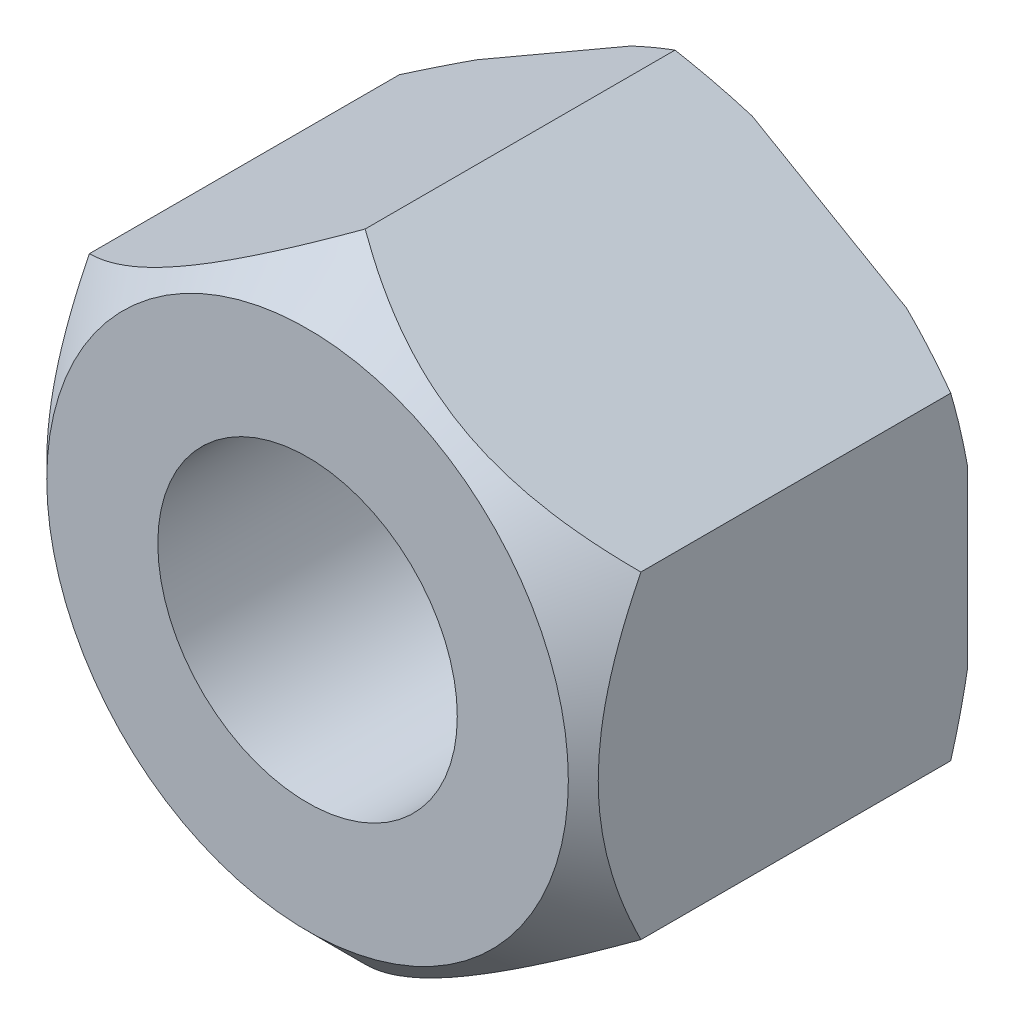
from build123d import *

# Parameters (mm, degrees)
SKETCH_1_R          = 2.067
EXTRUDE_552_DEPTH   = 5.3
SKETCH_2_OUTSIDE_W  = 42.884
SKETCH_2_OUTSIDE_H  = 44.062
SKETCH_2_OUTSIDE_R  = 4
CUT_EXTRUDE_1_DEPTH = 8.867213214
CUT_EXTRUDE_1_DRAFT = -60
CHAMFER_1_SIZE      = 0.123511905
SKETCH_9_OUTSIDE_W  = 29.902
SKETCH_9_OUTSIDE_H  = 31.08
SKETCH_9_OUTSIDE_R  = 3.6
CUT_EXTRUDE_7_DEPTH = 8.867213214
CUT_EXTRUDE_7_DRAFT = -45


with BuildPart() as part:
    # 草图1 → Extrude 552 (new body)
    with BuildSketch(Plane.XY):
        Polygon((0, 4.395), (-3.80618165, 2.1975), (-3.80618165, -2.1975), (0, -4.395), (3.80618165, -2.1975), (3.80618165, 2.1975), align=None)
        Circle(SKETCH_1_R, mode=Mode.SUBTRACT)
    extrude(amount=EXTRUDE_552_DEPTH)


with BuildPart() as cut_extrude_1_tool:
    # 草图2 outside → 切除-拉伸1 (with draft: the straight prism first)
    with BuildSketch(Plane(origin=(0, 0, 0), x_dir=(-1, 0, 0), z_dir=(0, 0, -1))):
        Rectangle(SKETCH_2_OUTSIDE_W, SKETCH_2_OUTSIDE_H)
        Circle(SKETCH_2_OUTSIDE_R, mode=Mode.SUBTRACT)
    extrude(amount=-CUT_EXTRUDE_1_DEPTH)
    # 切除-拉伸1: the draft: its side faces are tilted about the plane it starts from
    cut_extrude_1_sides = [cut_extrude_1_tool.faces().sort_by_distance(p)[0] for p in [
        (0, -22.031, 4.433606607),
        (-21.442, 0, 4.433606607),
        (0, 22.031, 4.433606607),
        (21.442, 0, 4.433606607),
        (4, 0, 4.433606607),
    ]]
    draft(cut_extrude_1_sides, Plane(origin=(0, 0, 0), x_dir=(-1, 0, 0), z_dir=(0, 0, -1)), CUT_EXTRUDE_1_DRAFT)


with BuildPart() as part_1:
    add(part.part)

    # 切除-拉伸1: cut by cut_extrude_1_tool
    add(cut_extrude_1_tool.part, mode=Mode.SUBTRACT)

    # 倒角1
    chamfer_1_edges = [part_1.edges().sort_by_distance(p)[0] for p in [
        (-2.067, 0, 0),
    ]]
    chamfer(chamfer_1_edges, length=CHAMFER_1_SIZE)


with BuildPart() as cut_extrude_7_tool:
    # 草图9 outside → 切除-拉伸7 (with draft: the straight prism first)
    with BuildSketch(Plane.XY.offset(5.3)):
        Rectangle(SKETCH_9_OUTSIDE_W, SKETCH_9_OUTSIDE_H)
        Circle(SKETCH_9_OUTSIDE_R, mode=Mode.SUBTRACT)
    extrude(amount=-CUT_EXTRUDE_7_DEPTH)
    # 切除-拉伸7: the draft: its side faces are tilted about the plane it starts from
    cut_extrude_7_sides = [cut_extrude_7_tool.faces().sort_by_distance(p)[0] for p in [
        (0, -15.54, 0.866393393),
        (14.951, 0, 0.866393393),
        (0, 15.54, 0.866393393),
        (-14.951, 0, 0.866393393),
        (-3.6, 0, 0.866393393),
    ]]
    draft(cut_extrude_7_sides, Plane.XY.offset(5.3), CUT_EXTRUDE_7_DRAFT)


with BuildPart() as part_2:
    add(part_1.part)

    # 切除-拉伸7: cut by cut_extrude_7_tool
    add(cut_extrude_7_tool.part, mode=Mode.SUBTRACT)


solid = part_2.part
